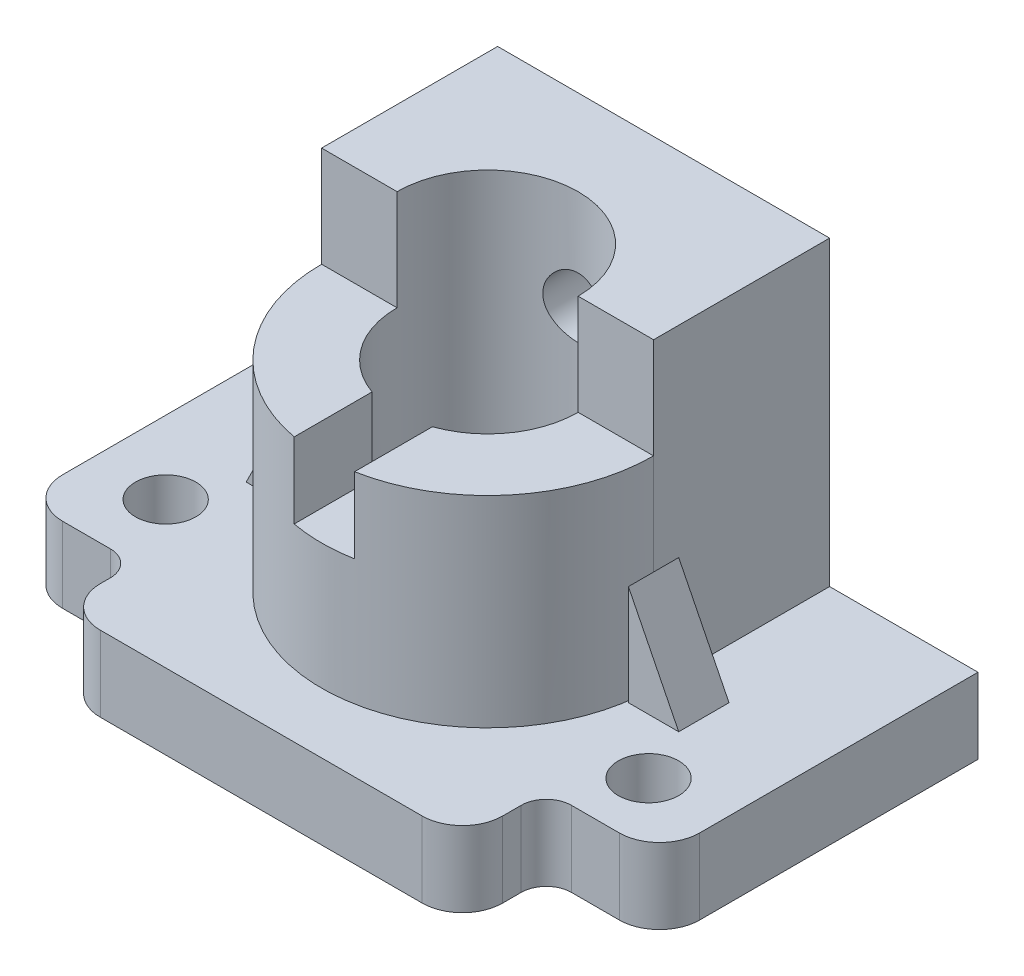
from build123d import *

# Parameters (mm, degrees)
SKETCH_1_R               = 6
EXTRUDE_1_DEPTH          = 15
FILLET_1_R               = 8
FILLET_2_R               = 8
FILLET_3_R               = 5
EXTRUDE_3_DEPTH          = 60
CUT_EXTRUDE_START        = -20
SKETCH_5_R               = 18
CUT_EXTRUDE_1_DEPTH      = 20
CUT_EXTRUDE_START_2      = -15
CUT_EXTRUDE_2_DEPTH      = 15
CUT_EXTRUDE_3_REACH      = 168.283
CUT_EXTRUDE_3_END_RADIUS = 18
SKETCH_7_R               = 6
EXTRUDE_4_DEPTH          = 10


with BuildPart() as part:
    # 草图1 → 凸台-拉伸1 (new body)
    with BuildSketch(Plane(origin=(0, 0, 0), x_dir=(1, 0, 0), z_dir=(0, 1, 0))):
        Polygon((0, 0), (0, -65), (22.5, -65), (22.5, -80), (102.5, -80), (102.5, -63.32326284), (125, -63.32326284), (125, 0), align=None)
        with Locations(Location((14.5, -51, 0), (0, 0, 270))):
            Circle(SKETCH_1_R, mode=Mode.SUBTRACT)
        with Locations(Location((110.5, -51, 0), (0, 0, 270))):
            Circle(SKETCH_1_R, mode=Mode.SUBTRACT)
    extrude(amount=EXTRUDE_1_DEPTH)

    # 圆角1
    fillet_1_edges = [part.edges().sort_by_distance(p)[0] for p in [
        (125, 7.5, 63.32326284),
        (0, 7.5, 65),
    ]]
    fillet(fillet_1_edges, radius=FILLET_1_R)

    # 圆角2
    fillet_2_edges = [part.edges().sort_by_distance(p)[0] for p in [
        (102.5, 7.5, 80),
        (22.5, 7.5, 80),
    ]]
    fillet(fillet_2_edges, radius=FILLET_2_R)

    # 圆角3
    fillet_3_edges = [part.edges().sort_by_distance(p)[0] for p in [
        (102.5, 7.5, 63.32326284),
        (22.5, 7.5, 65),
    ]]
    fillet(fillet_3_edges, radius=FILLET_3_R)

    # 草图2 → 凸台-拉伸3 (add)
    with BuildSketch(Plane(origin=(0, 15, 0), x_dir=(1, 0, 0), z_dir=(0, 1, 0))):
        with BuildLine():
            Line((95.5, 0), (62.5, 0))
            Line((62.5, 0), (62.5, -17))
            ThreePointArc((62.5, -17), (75.227922061, -22.272077939), (80.5, -35))
            Line((80.5, -35), (95.5, -35))
            Line((95.5, -35), (95.5, 0))
        make_face()
        with BuildLine():
            Line((62.5, -17), (62.5, 0))
            Line((62.5, 0), (29.5, 0))
            Line((29.5, 0), (29.5, -35))
            Line((29.5, -35), (44.5, -35))
            ThreePointArc((44.5, -35), (49.772077939, -22.272077939), (62.5, -17))
        make_face()
        with BuildLine():
            Line((95.5, -35), (80.5, -35))
            ThreePointArc((80.5, -35), (62.5, -53), (44.5, -35))
            Line((44.5, -35), (29.5, -35))
            ThreePointArc((29.5, -35), (62.5, -68), (95.5, -35))
        make_face()
    extrude(amount=EXTRUDE_3_DEPTH)

    # 草图5 → 切除-拉伸1 (cut)
    with BuildSketch(Plane(origin=(0, 75, 0), x_dir=(1, 0, 0), z_dir=(0, 1, 0)).offset(CUT_EXTRUDE_START)):
        with Locations((62.5, -35)):
            Circle(SKETCH_5_R)
        with BuildLine():
            Line((29.5, -35), (95.5, -35))
            ThreePointArc((95.5, -35), (62.5, -68), (29.5, -35))
        make_face()
    extrude(amount=CUT_EXTRUDE_1_DEPTH, mode=Mode.SUBTRACT)

    # 草图6 → 切除-拉伸2 (cut)
    with BuildSketch(Plane(origin=(0, 55, 0), x_dir=(1, 0, 0), z_dir=(0, 1, 0)).offset(CUT_EXTRUDE_START_2)):
        with BuildLine():
            Line((56.5, -51.970562748), (56.5, -67.449961479))
            ThreePointArc((56.5, -67.449961479), (59.487420442, -67.862202671), (62.5, -68))
            Line((62.5, -68), (62.5, -53))
            ThreePointArc((62.5, -53), (59.456164383, -52.740774074), (56.5, -51.970562748))
        make_face()
        with BuildLine():
            Line((62.5, -53), (62.5, -68))
            ThreePointArc((62.5, -68), (65.512579558, -67.862202671), (68.5, -67.449961479))
            Line((68.5, -67.449961479), (68.5, -51.970562748))
            ThreePointArc((68.5, -51.970562748), (65.543835617, -52.740774074), (62.5, -53))
        make_face()
    extrude(amount=CUT_EXTRUDE_2_DEPTH, mode=Mode.SUBTRACT)

    # 切除-拉伸3: up to this cylinder (the profile starts outside it)
    cut_extrude_3_end = Plane(origin=(62.5, 55, 35), z_dir=(0, -1, 0)) * Cylinder(CUT_EXTRUDE_3_END_RADIUS, 373.566, mode=Mode.PRIVATE)
    # 草图7 → 切除-拉伸3 (cut, up to the surface)
    with BuildSketch(Plane(origin=(0, 0, 0), x_dir=(-1, 0, 0), z_dir=(0, 0, -1)), mode=Mode.PRIVATE) as cut_extrude_3_sk1:
        with Locations((-62.5, 55)):
            Circle(SKETCH_7_R)
    cut_extrude_3_tool1 = extrude(cut_extrude_3_sk1.sketch, amount=-CUT_EXTRUDE_3_REACH, mode=Mode.PRIVATE) - cut_extrude_3_end
    add(cut_extrude_3_tool1.solids().sort_by_distance((62.5, 55, 0))[0], mode=Mode.SUBTRACT)

    # 草图10 → 凸台-拉伸4 (add)
    with BuildSketch(Plane(origin=(0, 0, 30), x_dir=(-1, 0, 0), z_dir=(0, 0, -1))):
        Polygon((-95.5, 15), (-105.5, 15), (-95.5, 35), align=None)
        Polygon((-19.5, 15), (-29.5, 35), (-29.5, 15), align=None)
    extrude(amount=-EXTRUDE_4_DEPTH)


solid = part.part
